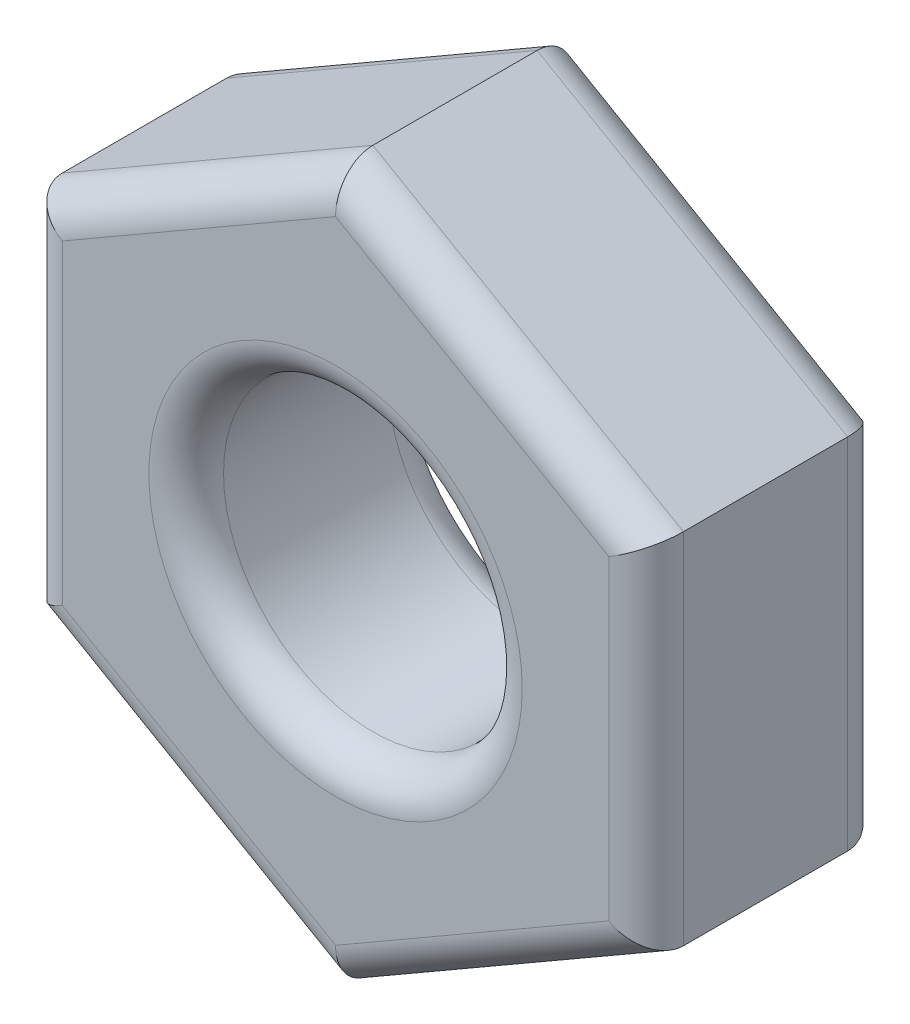
from build123d import *

# Parameters (mm, degrees)
SKETCH1_R           = 1
BOSS_EXTRUDE1_DEPTH = 0.8
FILLET1_R           = 0.25


with BuildPart() as part:
    # Sketch1 → Boss-Extrude1 (new, symmetric)
    with BuildSketch(Plane.XY):
        Polygon((2.08, -1.20088856), (2.08, 1.20088856), (0, 2.40177712), (-2.08, 1.20088856), (-2.08, -1.20088856), (0, -2.40177712), align=None)
        Circle(SKETCH1_R, mode=Mode.SUBTRACT)
    extrude(amount=BOSS_EXTRUDE1_DEPTH, both=True)

    # Fillet1
    fillet1_edges = [part.edges().sort_by_distance(p)[0] for p in [
        (1.04, 1.80133284, 0.8),
        (-1.04, 1.80133284, 0.8),
        (-1, 0, -0.8),
        (-1, 0, 0.8),
        (-2.08, 0, 0.8),
        (-1.04, -1.80133284, 0.8),
        (1.04, -1.80133284, 0.8),
        (-1.04, -1.80133284, -0.8),
        (-2.08, 0, -0.8),
        (-1.04, 1.80133284, -0.8),
        (1.04, 1.80133284, -0.8),
        (2.08, 0, -0.8),
        (1.04, -1.80133284, -0.8),
        (2.08, 0, 0.8),
    ]]
    fillet(fillet1_edges, radius=FILLET1_R)


solid = part.part
